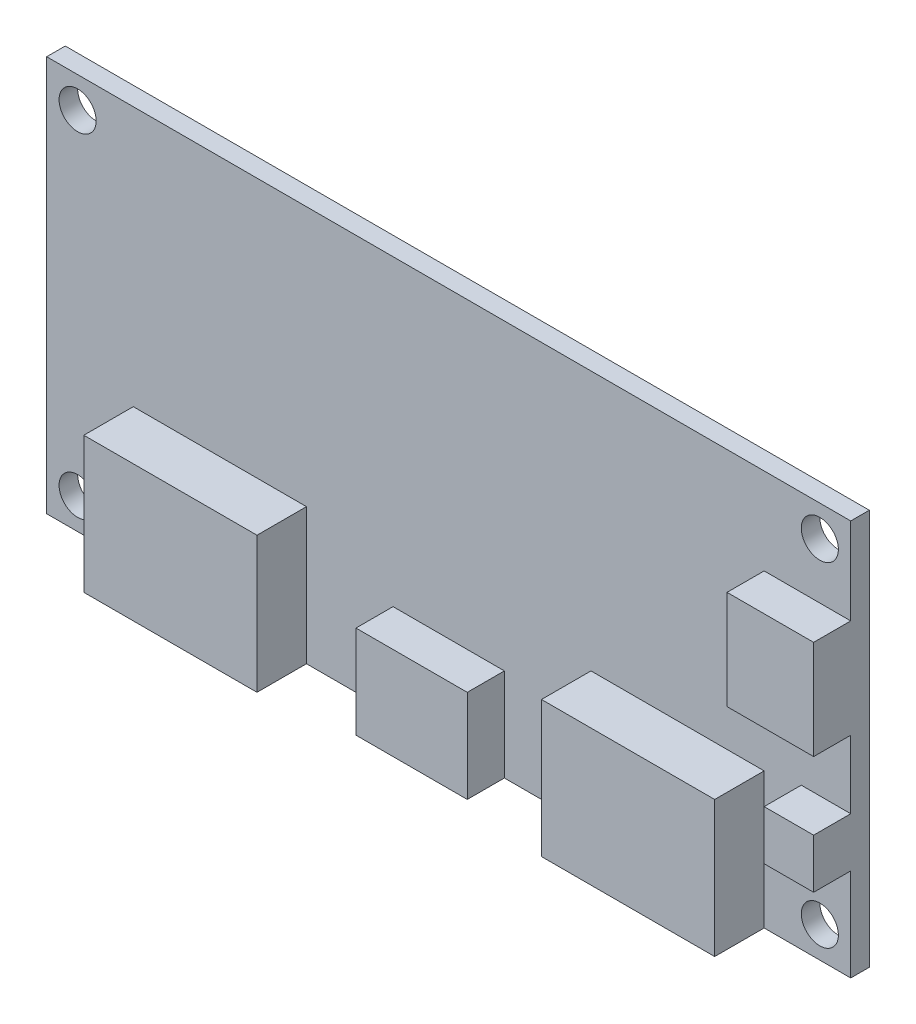
from build123d import *

# Parameters (mm, degrees)
SKETCH1_W           = 65
SKETCH1_H           = 32
SKETCH1_R           = 1.5
BOSS_EXTRUDE1_DEPTH = 1.5
SKETCH2_W           = 14
SKETCH2_H           = 11
BOSS_EXTRUDE2_DEPTH = 4
SKETCH3_W           = 7
SKETCH3_H           = 8
SKETCH3_W_2         = 4
SKETCH3_H_2         = 4
SKETCH3_W_3         = 9
SKETCH3_H_3         = 7.5
BOSS_EXTRUDE3_DEPTH = 3


with BuildPart() as part:
    # Sketch1 → Boss-Extrude1 (new body)
    with BuildSketch(Plane.XY):
        with Locations((32.5, 16)):
            Rectangle(SKETCH1_W, SKETCH1_H)
        with Locations((2.5, 2.5)):
            Circle(SKETCH1_R, mode=Mode.SUBTRACT)
        with Locations((2.5, 29.5)):
            Circle(SKETCH1_R, mode=Mode.SUBTRACT)
        with Locations((62.5, 29.5)):
            Circle(SKETCH1_R, mode=Mode.SUBTRACT)
        with Locations((62.5, 2.5)):
            Circle(SKETCH1_R, mode=Mode.SUBTRACT)
    extrude(amount=BOSS_EXTRUDE1_DEPTH)

    # Sketch2 → Boss-Extrude2 (add)
    with BuildSketch(Plane.XY.offset(1.5)):
        with Locations((14, 5.5)):
            Rectangle(SKETCH2_W, SKETCH2_H)
        with Locations((51, 5.5)):
            Rectangle(SKETCH2_W, SKETCH2_H)
    extrude(amount=BOSS_EXTRUDE2_DEPTH)

    # Sketch3 → Boss-Extrude3 (add)
    with BuildSketch(Plane.XY.offset(1.5)):
        with Locations((61.5, 21)):
            Rectangle(SKETCH3_W, SKETCH3_H)
        with Locations((63, 9.5)):
            Rectangle(SKETCH3_W_2, SKETCH3_H_2)
        with Locations((32.5, 3.75)):
            Rectangle(SKETCH3_W_3, SKETCH3_H_3)
    extrude(amount=BOSS_EXTRUDE3_DEPTH)


solid = part.part
